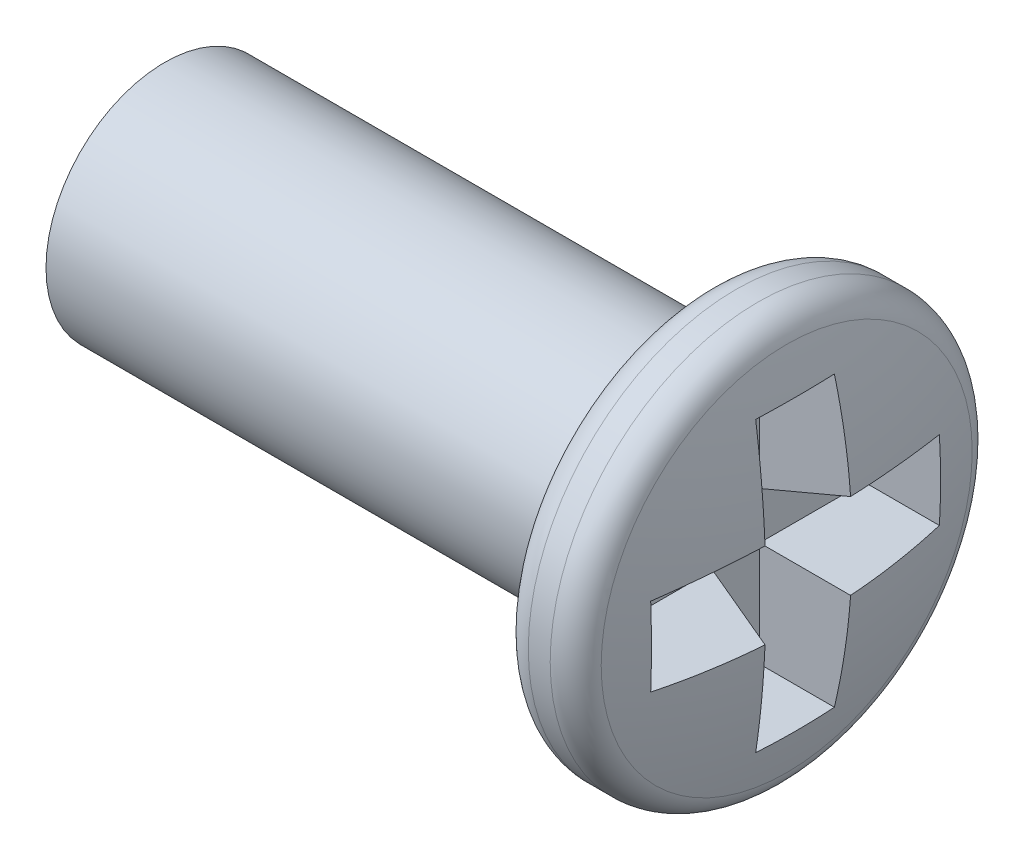
from build123d import *

# Parameters (mm, degrees)
FILLET1_R          = 0.2
CUT_EXTRUDE1_DEPTH = 0.5
CUT_EXTRUDE1_DRAFT = -15


with BuildPart() as part:
    # Sketch1 → Revolve1 (revolve)
    with BuildSketch(Plane.XY, mode=Mode.PRIVATE) as revolve1_sk:
        with BuildLine():
            Line((0, 0), (4.35, 0))
            ThreePointArc((4.35, 0), (4.299747468, 0.707106781), (4.15, 1.4))
            Line((4.15, 1.4), (3.65, 1.4))
            Line((3.65, 1.4), (3.65, 0.8))
            Line((3.65, 0.8), (0, 0.8))
            Line((0, 0.8), (0, 0))
        make_face()
    revolve(revolve1_sk.sketch.rotate(Axis((-102.03816923, 0, 0), (1, 0, 0)), 90), axis=Axis((-102.03816923, 0, 0), (1, 0, 0)))

    # Fillet1
    fillet1_edges = [part.edges().sort_by_distance(p)[0] for p in [
        (3.65, 0, -1.4),
        (4.15, 0, -1.4),
    ]]
    fillet(fillet1_edges, radius=FILLET1_R)


with BuildPart() as cut_extrude1_tool:
    # Sketch2 → Cut-Extrude1 (with draft: the straight prism first)
    with BuildSketch(Plane(origin=(4.35, 0, 0), x_dir=(0, 0, -1), z_dir=(1, 0, 0))):
        Polygon((0.29273093, 1), (-0.29273093, 1), (-0.29273093, 0.29273093), (-1, 0.29273093), (-1, -0.29273093), (-0.29273093, -0.29273093), (-0.29273093, -1), (0.29273093, -1), (0.29273093, -0.29273093), (1, -0.29273093), (1, 0.29273093), (0.29273093, 0.29273093), align=None)
    extrude(amount=-CUT_EXTRUDE1_DEPTH)
    # Cut-Extrude1: the draft: its side faces are tilted about the plane it starts from
    cut_extrude1_sides = [cut_extrude1_tool.faces().sort_by_distance(p)[0] for p in [
        (4.1, 1, 0),
        (4.1, 0.646365465, 0.29273093),
        (4.1, 0.29273093, 0.646365465),
        (4.1, 0, 1),
        (4.1, -0.29273093, 0.646365465),
        (4.1, -0.646365465, 0.29273093),
        (4.1, -1, 0),
        (4.1, -0.646365465, -0.29273093),
        (4.1, -0.29273093, -0.646365465),
        (4.1, 0, -1),
        (4.1, 0.29273093, -0.646365465),
        (4.1, 0.646365465, -0.29273093),
    ]]
    draft(cut_extrude1_sides, Plane(origin=(4.35, 0, 0), x_dir=(0, 0, -1), z_dir=(1, 0, 0)), CUT_EXTRUDE1_DRAFT)


with BuildPart() as part_1:
    add(part.part)

    # Cut-Extrude1: cut by cut_extrude1_tool
    add(cut_extrude1_tool.part, mode=Mode.SUBTRACT)


solid = part_1.part
